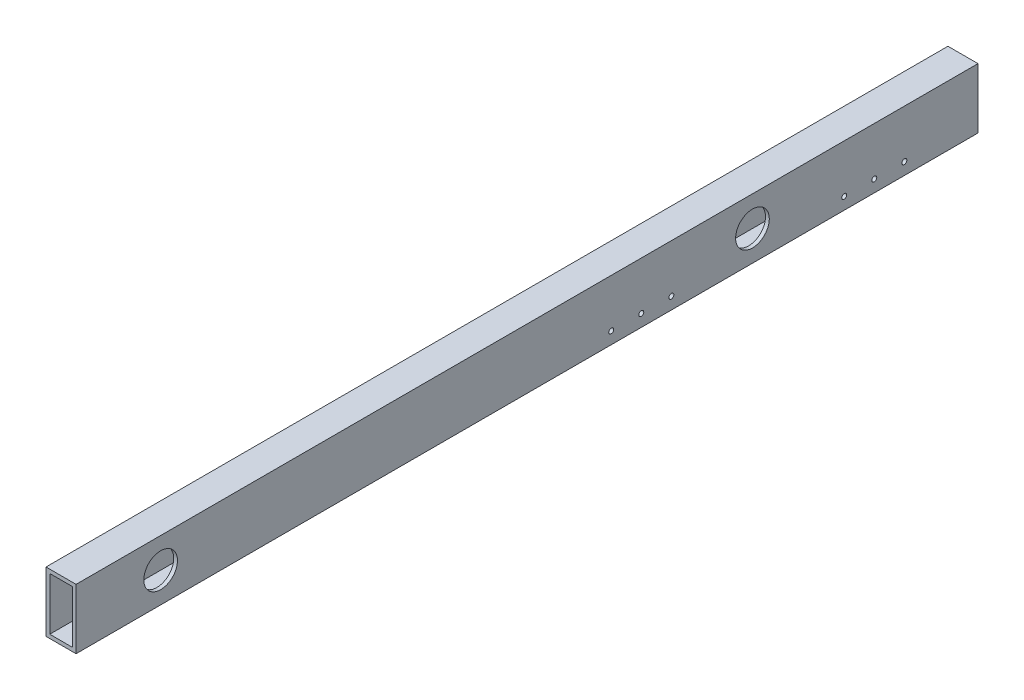
from build123d import *

# Parameters (mm, degrees)
SKETCH1_W           = 25.4
SKETCH1_H           = 50.8
SKETCH1_W_2         = 19.05
SKETCH1_H_2         = 44.45
BOSS_EXTRUDE1_DEPTH = 762
CUT_EXTRUDE1_REACH  = 764.846
SKETCH4_R           = 14.224
SKETCH5_R           = 2.0955
CUT_EXTRUDE2_DEPTH  = 3.175
CUT_EXTRUDE3_REACH  = 764.846
SKETCH7_R           = 2.0955


with BuildPart() as part:
    # Sketch1 → Boss-Extrude1 (new body)
    with BuildSketch(Plane.XY):
        Rectangle(SKETCH1_W, SKETCH1_H)
        Rectangle(SKETCH1_W_2, SKETCH1_H_2, mode=Mode.SUBTRACT)
    extrude(amount=BOSS_EXTRUDE1_DEPTH)

    # Cut-Extrude1: up to this face of the body (flat: up to its plane)
    cut_extrude1_end = Plane(part.part.faces().sort_by_distance((-12.7, 0, 381))[0])
    # Sketch4 → Cut-Extrude1 (cut, up to the picked face)
    with BuildSketch(Plane(origin=(12.7, 0, 0), x_dir=(0, 0, -1), z_dir=(1, 0, 0)), mode=Mode.PRIVATE) as cut_extrude1_sk1:
        with Locations(Location((-690.548048411, 0, 0), (0, 0, 90))):
            Circle(SKETCH4_R)
    cut_extrude1_tool1 = split(extrude(cut_extrude1_sk1.sketch, amount=-CUT_EXTRUDE1_REACH, mode=Mode.PRIVATE), bisect_by=cut_extrude1_end, keep=Keep.BOTH, mode=Mode.PRIVATE)
    # Sketch4 → Cut-Extrude1 (cut, up to the picked face)
    with BuildSketch(Plane(origin=(12.7, 0, 0), x_dir=(0, 0, -1), z_dir=(1, 0, 0)), mode=Mode.PRIVATE) as cut_extrude1_sk2:
        with Locations(Location((-190.549048411, 0, 0), (0, 0, 90))):
            Circle(SKETCH4_R)
    cut_extrude1_tool2 = split(extrude(cut_extrude1_sk2.sketch, amount=-CUT_EXTRUDE1_REACH, mode=Mode.PRIVATE), bisect_by=cut_extrude1_end, keep=Keep.BOTH, mode=Mode.PRIVATE)
    add(cut_extrude1_tool1.solids().sort_by(Axis((12.7, 0, 690.548048), (-1, 0, 0)))[0], mode=Mode.SUBTRACT)
    add(cut_extrude1_tool2.solids().sort_by(Axis((12.7, 0, 190.549048), (-1, 0, 0)))[0], mode=Mode.SUBTRACT)

    # Sketch5 → Cut-Extrude2 (cut)
    with BuildSketch(Plane.XZ.offset(25.4)):
        with Locations(Location((2.54, 264.16, 0), (0, 0, 270))):
            Circle(SKETCH5_R)
        with Locations(Location((2.54, 289.56, 0), (0, 0, 270))):
            Circle(SKETCH5_R)
        with Locations(Location((2.54, 314.96, 0), (0, 0, 270))):
            Circle(SKETCH5_R)
        with Locations(Location((-2.54, 264.16, 0), (0, 0, 180))):
            Circle(SKETCH5_R)
        with Locations(Location((-2.54, 289.56, 0), (0, 0, 180))):
            Circle(SKETCH5_R)
        with Locations(Location((-2.54, 314.96, 0), (0, 0, 180))):
            Circle(SKETCH5_R)
    extrude(amount=-CUT_EXTRUDE2_DEPTH, mode=Mode.SUBTRACT)

    # Cut-Extrude3: up to this face of the body (flat: up to its plane)
    cut_extrude3_end = Plane(part.part.faces().sort_by_distance((-12.7, 0, 378.978016644))[0])
    # Sketch7 → Cut-Extrude3 (cut, up to the picked face)
    with BuildSketch(Plane(origin=(12.7, 0, 0), x_dir=(0, 0, -1), z_dir=(1, 0, 0)), mode=Mode.PRIVATE) as cut_extrude3_sk1:
        with Locations(Location((-259.08, -15.24, 0), (0, 0, 90))):
            Circle(SKETCH7_R)
    cut_extrude3_tool1 = split(extrude(cut_extrude3_sk1.sketch, amount=-CUT_EXTRUDE3_REACH, mode=Mode.PRIVATE), bisect_by=cut_extrude3_end, keep=Keep.BOTH, mode=Mode.PRIVATE)
    # Sketch7 → Cut-Extrude3 (cut, up to the picked face)
    with BuildSketch(Plane(origin=(12.7, 0, 0), x_dir=(0, 0, -1), z_dir=(1, 0, 0)), mode=Mode.PRIVATE) as cut_extrude3_sk2:
        with Locations(Location((-284.48, -15.24, 0), (0, 0, 90))):
            Circle(SKETCH7_R)
    cut_extrude3_tool2 = split(extrude(cut_extrude3_sk2.sketch, amount=-CUT_EXTRUDE3_REACH, mode=Mode.PRIVATE), bisect_by=cut_extrude3_end, keep=Keep.BOTH, mode=Mode.PRIVATE)
    # Sketch7 → Cut-Extrude3 (cut, up to the picked face)
    with BuildSketch(Plane(origin=(12.7, 0, 0), x_dir=(0, 0, -1), z_dir=(1, 0, 0)), mode=Mode.PRIVATE) as cut_extrude3_sk3:
        with Locations(Location((-309.88, -15.24, 0), (0, 0, 90))):
            Circle(SKETCH7_R)
    cut_extrude3_tool3 = split(extrude(cut_extrude3_sk3.sketch, amount=-CUT_EXTRUDE3_REACH, mode=Mode.PRIVATE), bisect_by=cut_extrude3_end, keep=Keep.BOTH, mode=Mode.PRIVATE)
    # Sketch7 → Cut-Extrude3 (cut, up to the picked face)
    with BuildSketch(Plane(origin=(12.7, 0, 0), x_dir=(0, 0, -1), z_dir=(1, 0, 0)), mode=Mode.PRIVATE) as cut_extrude3_sk4:
        with Locations(Location((-87.63, -15.24, 0), (0, 0, 90))):
            Circle(SKETCH7_R)
    cut_extrude3_tool4 = split(extrude(cut_extrude3_sk4.sketch, amount=-CUT_EXTRUDE3_REACH, mode=Mode.PRIVATE), bisect_by=cut_extrude3_end, keep=Keep.BOTH, mode=Mode.PRIVATE)
    # Sketch7 → Cut-Extrude3 (cut, up to the picked face)
    with BuildSketch(Plane(origin=(12.7, 0, 0), x_dir=(0, 0, -1), z_dir=(1, 0, 0)), mode=Mode.PRIVATE) as cut_extrude3_sk5:
        with Locations(Location((-62.23, -15.24, 0), (0, 0, 90))):
            Circle(SKETCH7_R)
    cut_extrude3_tool5 = split(extrude(cut_extrude3_sk5.sketch, amount=-CUT_EXTRUDE3_REACH, mode=Mode.PRIVATE), bisect_by=cut_extrude3_end, keep=Keep.BOTH, mode=Mode.PRIVATE)
    # Sketch7 → Cut-Extrude3 (cut, up to the picked face)
    with BuildSketch(Plane(origin=(12.7, 0, 0), x_dir=(0, 0, -1), z_dir=(1, 0, 0)), mode=Mode.PRIVATE) as cut_extrude3_sk6:
        with Locations(Location((-113.03, -15.24, 0), (0, 0, 90))):
            Circle(SKETCH7_R)
    cut_extrude3_tool6 = split(extrude(cut_extrude3_sk6.sketch, amount=-CUT_EXTRUDE3_REACH, mode=Mode.PRIVATE), bisect_by=cut_extrude3_end, keep=Keep.BOTH, mode=Mode.PRIVATE)
    add(cut_extrude3_tool1.solids().sort_by(Axis((12.7, -15.24, 259.08), (-1, 0, 0)))[0], mode=Mode.SUBTRACT)
    add(cut_extrude3_tool2.solids().sort_by(Axis((12.7, -15.24, 284.48), (-1, 0, 0)))[0], mode=Mode.SUBTRACT)
    add(cut_extrude3_tool3.solids().sort_by(Axis((12.7, -15.24, 309.88), (-1, 0, 0)))[0], mode=Mode.SUBTRACT)
    add(cut_extrude3_tool4.solids().sort_by(Axis((12.7, -15.24, 87.63), (-1, 0, 0)))[0], mode=Mode.SUBTRACT)
    add(cut_extrude3_tool5.solids().sort_by(Axis((12.7, -15.24, 62.23), (-1, 0, 0)))[0], mode=Mode.SUBTRACT)
    add(cut_extrude3_tool6.solids().sort_by(Axis((12.7, -15.24, 113.03), (-1, 0, 0)))[0], mode=Mode.SUBTRACT)


solid = part.part
